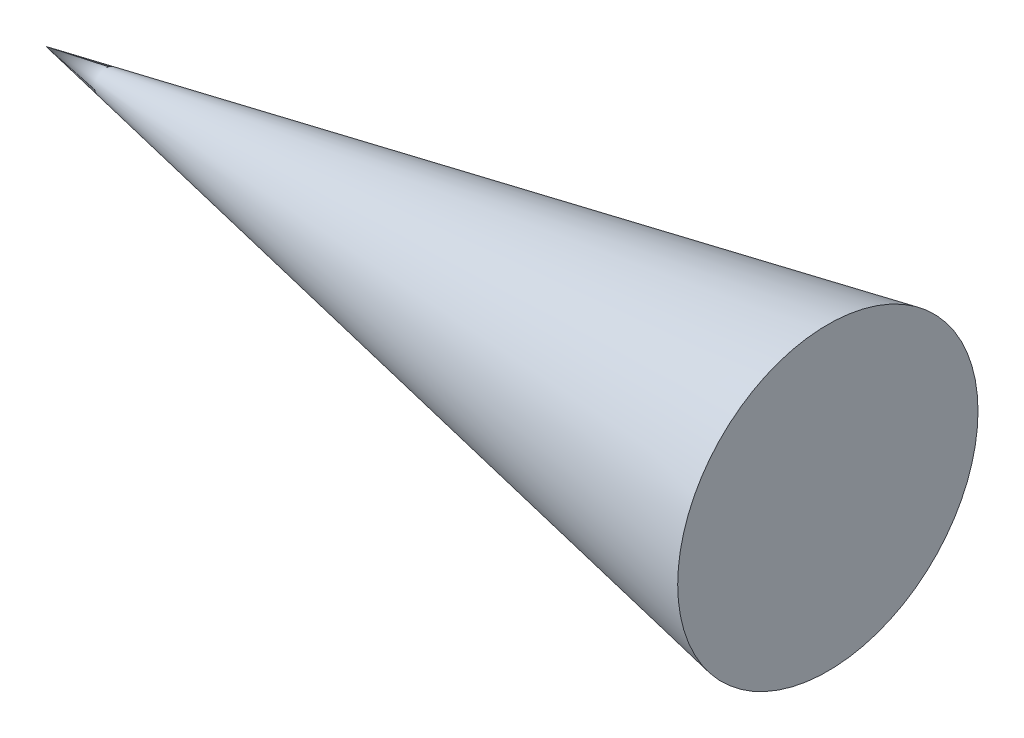
from build123d import *


with BuildPart() as part:
    # 草图1 → 旋转1 (revolve)
    with BuildSketch(Plane.XY, mode=Mode.PRIVATE) as revolve_1_sk:
        Polygon((0, 0), (88.725690859, 0), (88.725690859, 17.040328405), align=None)
    revolve(revolve_1_sk.sketch.rotate(Axis((0, 0, 0), (1, 0, 0)), 270), axis=Axis((0, 0, 0), (1, 0, 0)))


solid = part.part
